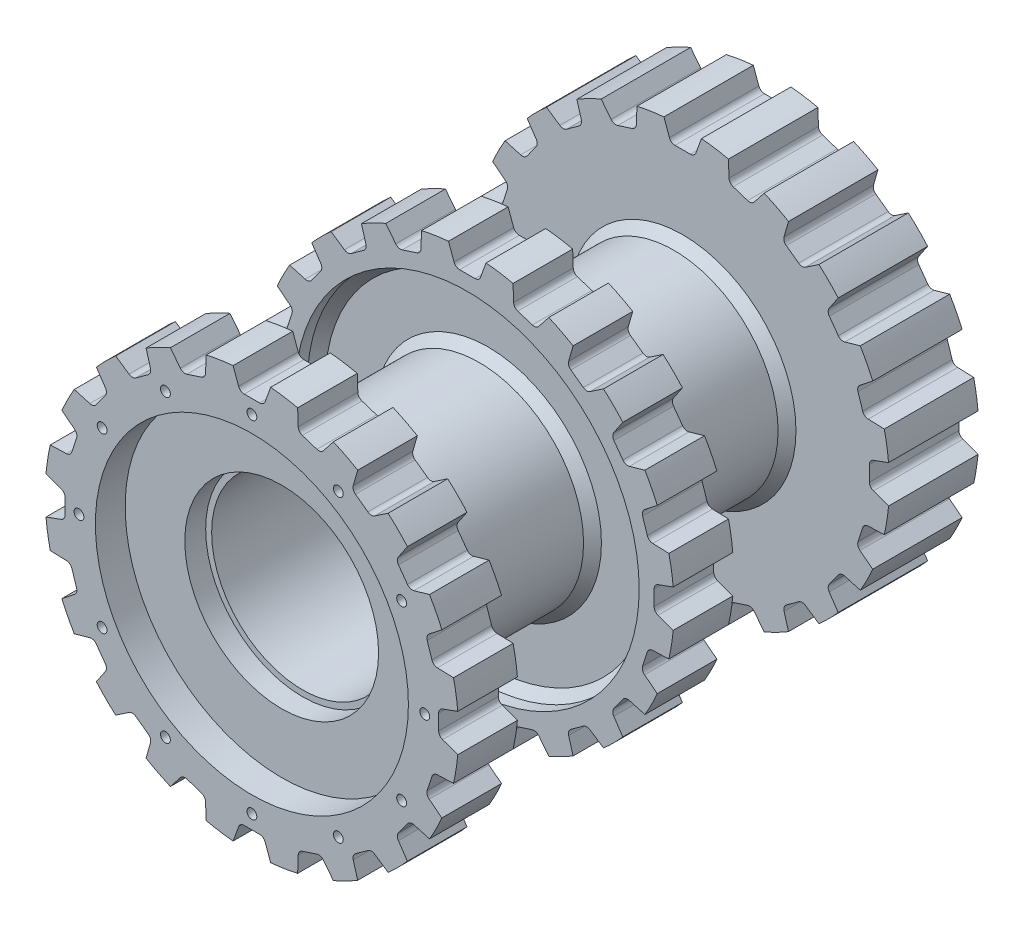
from build123d import *

# Parameters (mm, degrees)
SKETCH1_R                = 69.344372204
BASE_EXTRUDE_DEPTH       = 87.25
CUT_EXTRUDE1_DEPTH       = 132.262509548
FILLET1_R                = 2
CIRPATTERN1_COUNT        = 20
FILLET1_OF_CIRPATTERN1_R = 2
SKETCH3_R                = 30.5
CUT_EXTRUDE2_DEPTH       = 200
SKETCH4_R                = 32.5
CUT_EXTRUDE3_DEPTH       = 17
CUT_EXTRUDE4_START       = -27
SKETCH5_R                = 32.5
CUT_EXTRUDE4_DEPTH       = 27
SKETCH7_R                = 52.5
CUT_EXTRUDE6_DEPTH       = 20
CUT_EXTRUDE8_START       = -10
SKETCH12_R               = 52.5
CUT_EXTRUDE8_DEPTH       = 10
SKETCH13_R               = 1.65
CUT_EXTRUDE9_DEPTH       = 15
SKETCH14_W               = 65.184174007
SKETCH14_H               = 52.25
SKETCH14_W_2             = 64.29863976
SKETCH15_W               = 22.657598832
SKETCH15_H               = 10.666754838
CHAMFER1_SIZE            = 3


with BuildPart() as part:
    # Sketch1 → Base-Extrude (new, symmetric)
    with BuildSketch(Plane.XY):
        Circle(SKETCH1_R)
    extrude(amount=BASE_EXTRUDE_DEPTH, both=True)

    # Sketch2 → Cut-Extrude1 (cut, symmetric)
    with BuildSketch(Plane.XY):
        Polygon((-117.610457831, 374.880568271), (-6.3, 69.057598832), (-3.970590501, 62.657598832), (3.970590501, 62.657598832), (6.3, 69.057598832), (117.610457831, 374.880568271), (117.610457831, 1025.780581052), (-117.610457831, 1025.780581052), align=None)
    cut_extrude1 = extrude(amount=CUT_EXTRUDE1_DEPTH, both=True, mode=Mode.SUBTRACT)

    # Fillet1
    fillet1_edges = [part.edges().sort_by_distance(p)[0] for p in [
        (-3.970590501, 62.657598832, 0),
        (3.970590501, 62.657598832, 0),
    ]]
    fillet(fillet1_edges, radius=FILLET1_R)

    # CirPattern1: Cut-Extrude1 ×20 about axis
    cirpattern1_axis = Axis((0, 0, -95.975), (0, 0, 1))
    for i in range(1, CIRPATTERN1_COUNT):
        add(cut_extrude1.rotate(cirpattern1_axis, i * 360 / CIRPATTERN1_COUNT), mode=Mode.SUBTRACT)

    # Fillet1 of CirPattern1
    fillet1_of_cirpattern1_edges = [part.edges().sort_by_distance(p)[0] for p in [
        (-23.138518835, 58.363937722, 0),
        (-15.586006897, 60.817897607, 0),
        (-40.04148773, 48.357207742, 0),
        (-33.616937345, 53.024916821, 0),
        (-53.024916821, 33.616937345, 0),
        (-48.357207742, 40.04148773, 0),
        (-60.817897607, 15.586006897, 0),
        (-58.363937722, 23.138518835, 0),
        (-62.657598832, -3.970590501, 0),
        (-62.657598832, 3.970590501, 0),
        (-58.363937722, -23.138518835, 0),
        (-60.817897607, -15.586006897, 0),
        (-48.357207742, -40.04148773, 0),
        (-53.024916821, -33.616937345, 0),
        (-33.616937345, -53.024916821, 0),
        (-40.04148773, -48.357207742, 0),
        (-15.586006897, -60.817897607, 0),
        (-23.138518835, -58.363937722, 0),
        (3.970590501, -62.657598832, 0),
        (-3.970590501, -62.657598832, 0),
        (23.138518835, -58.363937722, 0),
        (15.586006897, -60.817897607, 0),
        (40.04148773, -48.357207742, 0),
        (33.616937345, -53.024916821, 0),
        (53.024916821, -33.616937345, 0),
        (48.357207742, -40.04148773, 0),
        (60.817897607, -15.586006897, 0),
        (58.363937722, -23.138518835, 0),
        (62.657598832, 3.970590501, 0),
        (62.657598832, -3.970590501, 0),
        (58.363937722, 23.138518835, 0),
        (60.817897607, 15.586006897, 0),
        (48.357207742, 40.04148773, 0),
        (53.024916821, 33.616937345, 0),
        (33.616937345, 53.024916821, 0),
        (40.04148773, 48.357207742, 0),
        (15.586006897, 60.817897607, 0),
        (23.138518835, 58.363937722, 0),
    ]]
    fillet(fillet1_of_cirpattern1_edges, radius=FILLET1_OF_CIRPATTERN1_R)

    # Sketch3 → Cut-Extrude2 (cut)
    with BuildSketch(Plane.XY.offset(87.25)):
        Circle(SKETCH3_R)
    extrude(amount=-CUT_EXTRUDE2_DEPTH, mode=Mode.SUBTRACT)

    # Sketch4 → Cut-Extrude3 (cut)
    with BuildSketch(Plane.XY.offset(87.25)):
        Circle(SKETCH4_R)
    extrude(amount=-CUT_EXTRUDE3_DEPTH, mode=Mode.SUBTRACT)

    # Sketch5 → Cut-Extrude4 (cut)
    with BuildSketch(Plane(origin=(0, 0, -87.25), x_dir=(-1, 0, 0), z_dir=(0, 0, -1)).offset(CUT_EXTRUDE4_START)):
        Circle(SKETCH5_R)
    extrude(amount=CUT_EXTRUDE4_DEPTH, mode=Mode.SUBTRACT)

    # Sketch7 → Cut-Extrude6 (cut)
    with BuildSketch(Plane(origin=(0, 0, -87.25), x_dir=(-1, 0, 0), z_dir=(0, 0, -1))):
        Circle(SKETCH7_R)
    extrude(amount=-CUT_EXTRUDE6_DEPTH, mode=Mode.SUBTRACT)

    # Sketch12 → Cut-Extrude8 (cut)
    with BuildSketch(Plane.XY.offset(87.25).offset(CUT_EXTRUDE8_START)):
        Circle(SKETCH12_R)
    extrude(amount=CUT_EXTRUDE8_DEPTH, mode=Mode.SUBTRACT)

    # Sketch13 → Cut-Extrude9 (cut)
    with BuildSketch(Plane.XY.offset(87.25)):
        with Locations((0, 58)):
            Circle(SKETCH13_R)
        with Locations((29, 50.229473419)):
            Circle(SKETCH13_R)
        with Locations((50.229473419, 29)):
            Circle(SKETCH13_R)
        with Locations((58, 0)):
            Circle(SKETCH13_R)
        with Locations((50.229473419, -29)):
            Circle(SKETCH13_R)
        with Locations((29, -50.229473419)):
            Circle(SKETCH13_R)
        with Locations((0, -58)):
            Circle(SKETCH13_R)
        with Locations((-29, -50.229473419)):
            Circle(SKETCH13_R)
        with Locations((-50.229473419, -29)):
            Circle(SKETCH13_R)
        with Locations((-58, 0)):
            Circle(SKETCH13_R)
        with Locations((-50.229473419, 29)):
            Circle(SKETCH13_R)
        with Locations((-29, 50.229473419)):
            Circle(SKETCH13_R)
    cut_extrude9 = extrude(amount=-CUT_EXTRUDE9_DEPTH, mode=Mode.SUBTRACT)

    # Mirror1: Cut-Extrude9 across plane
    add(cut_extrude9.mirror(Plane(origin=(0, 0, 0), x_dir=(1, 0, 0), z_dir=(0, 0, -1))), mode=Mode.SUBTRACT)

    # Sketch14 → Cut-Revolve1 (revolve, cut)
    with BuildSketch(Plane(origin=(0, 0, 0), x_dir=(1, 0, 0), z_dir=(0, 1, 0))):
        with Locations((-67.592087004, 31.125)):
            Rectangle(SKETCH14_W, SKETCH14_H)
        with Locations((-67.14931988, -41.125)):
            Rectangle(SKETCH14_W_2, SKETCH14_H)
    revolve(axis=Axis((0, 0, 0), (0, 0, -1)), mode=Mode.SUBTRACT)

    # Sketch15 → Cut-Revolve2 (revolve, cut)
    with BuildSketch(Plane(origin=(0, 0, 0), x_dir=(1, 0, 0), z_dir=(0, 1, 0))):
        with Locations((-46.328799416, 3.333377419)):
            Rectangle(SKETCH15_W, SKETCH15_H)
        with Locations((-46.328799416, -13.333377419)):
            Rectangle(SKETCH15_W, SKETCH15_H)
    revolve(axis=Axis((0, 0, 0), (0, 0, -1)), mode=Mode.SUBTRACT)

    # Chamfer1
    chamfer1_edges = [part.edges().sort_by_distance(p)[0] for p in [
        (35, 0, -57.25),
        (35, 0, 67.25),
        (57.657598832, 0, 2),
        (57.657598832, 0, 8),
        (35, 0, 8),
        (35, 0, 2),
    ]]
    chamfer(chamfer1_edges, length=CHAMFER1_SIZE)


solid = part.part
